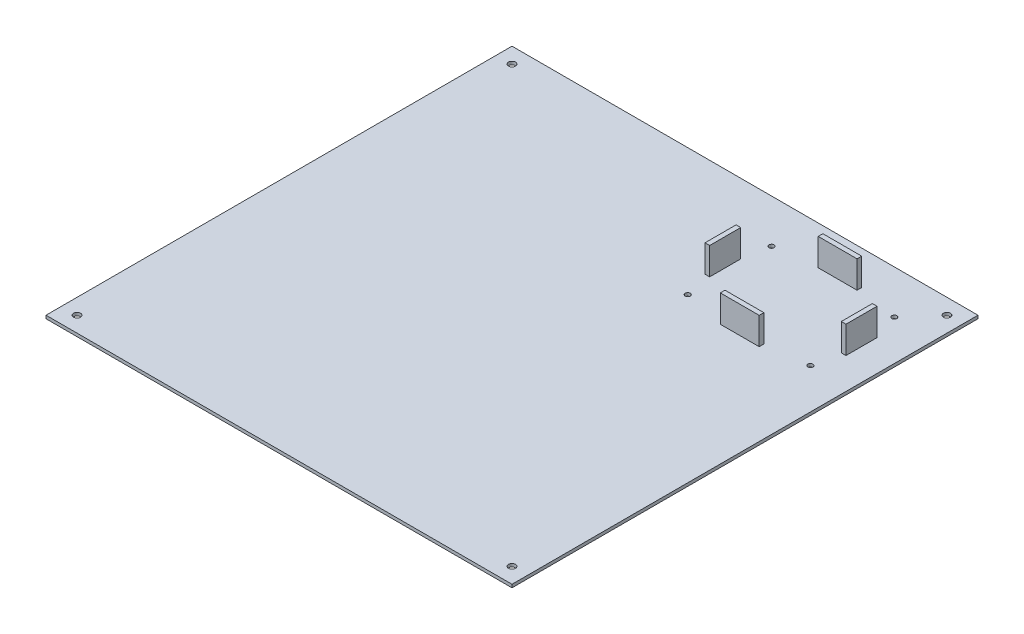
from build123d import *

# Parameters (mm, degrees)
SKETCH1_W           = 600
SKETCH1_H           = 600
SKETCH1_R           = 4.5
BOSS_EXTRUDE1_DEPTH = 4
CUT_EXTRUDE2_REACH  = 850.538
SKETCH4_R           = 3.25
SKETCH4_3_W         = 6
SKETCH4_3_H         = 40
SKETCH4_3_W_2       = 50
SKETCH4_3_H_2       = 6
BOSS_EXTRUDE2_DEPTH = 35


with BuildPart() as part:
    # Sketch1 → Boss-Extrude1 (new body)
    with BuildSketch(Plane(origin=(0, 0, 0), x_dir=(1, 0, 0), z_dir=(0, 1, 0))):
        with Locations((300, 300)):
            Rectangle(SKETCH1_W, SKETCH1_H)
        with Locations((20, 580)):
            Circle(SKETCH1_R, mode=Mode.SUBTRACT)
        with Locations((580, 580)):
            Circle(SKETCH1_R, mode=Mode.SUBTRACT)
        with Locations((580, 20)):
            Circle(SKETCH1_R, mode=Mode.SUBTRACT)
        with Locations((20, 20)):
            Circle(SKETCH1_R, mode=Mode.SUBTRACT)
    extrude(amount=BOSS_EXTRUDE1_DEPTH)

    # Sketch4 → Cut-Extrude2 (cut, up to next)
    with BuildSketch(Plane(origin=(0, 4, 0), x_dir=(1, 0, 0), z_dir=(0, 1, 0)), mode=Mode.PRIVATE) as cut_extrude2_sk1:
        with Locations((390.25, 544)):
            Circle(SKETCH4_R)
    cut_extrude2_tool1 = extrude(cut_extrude2_sk1.sketch, amount=-CUT_EXTRUDE2_REACH, mode=Mode.PRIVATE) & part.part
    # Sketch4 → Cut-Extrude2 (cut, up to next)
    with BuildSketch(Plane(origin=(0, 4, 0), x_dir=(1, 0, 0), z_dir=(0, 1, 0)), mode=Mode.PRIVATE) as cut_extrude2_sk2:
        with Locations((548.25, 544)):
            Circle(SKETCH4_R)
    cut_extrude2_tool2 = extrude(cut_extrude2_sk2.sketch, amount=-CUT_EXTRUDE2_REACH, mode=Mode.PRIVATE) & part.part
    # Sketch4 → Cut-Extrude2 (cut, up to next)
    with BuildSketch(Plane(origin=(0, 4, 0), x_dir=(1, 0, 0), z_dir=(0, 1, 0)), mode=Mode.PRIVATE) as cut_extrude2_sk3:
        with Locations((390.25, 436)):
            Circle(SKETCH4_R)
    cut_extrude2_tool3 = extrude(cut_extrude2_sk3.sketch, amount=-CUT_EXTRUDE2_REACH, mode=Mode.PRIVATE) & part.part
    # Sketch4 → Cut-Extrude2 (cut, up to next)
    with BuildSketch(Plane(origin=(0, 4, 0), x_dir=(1, 0, 0), z_dir=(0, 1, 0)), mode=Mode.PRIVATE) as cut_extrude2_sk4:
        with Locations((548.25, 436)):
            Circle(SKETCH4_R)
    cut_extrude2_tool4 = extrude(cut_extrude2_sk4.sketch, amount=-CUT_EXTRUDE2_REACH, mode=Mode.PRIVATE) & part.part
    add(cut_extrude2_tool1.solids().sort_by_distance((390.25, 4, -544))[0], mode=Mode.SUBTRACT)
    add(cut_extrude2_tool2.solids().sort_by_distance((548.25, 4, -544))[0], mode=Mode.SUBTRACT)
    add(cut_extrude2_tool3.solids().sort_by_distance((390.25, 4, -436))[0], mode=Mode.SUBTRACT)
    add(cut_extrude2_tool4.solids().sort_by_distance((548.25, 4, -436))[0], mode=Mode.SUBTRACT)

    # Sketch4<3> → Boss-Extrude2 (add)
    with BuildSketch(Plane(origin=(0, 4, 0), x_dir=(1, 0, 0), z_dir=(0, 1, 0))):
        with Locations((381.5, 490)):
            Rectangle(SKETCH4_3_W, SKETCH4_3_H)
        with Locations((469.25, 553)):
            Rectangle(SKETCH4_3_W_2, SKETCH4_3_H_2)
        with Locations((557, 490)):
            Rectangle(SKETCH4_3_W, SKETCH4_3_H)
        with Locations((469.25, 427)):
            Rectangle(SKETCH4_3_W_2, SKETCH4_3_H_2)
    extrude(amount=BOSS_EXTRUDE2_DEPTH)


solid = part.part
